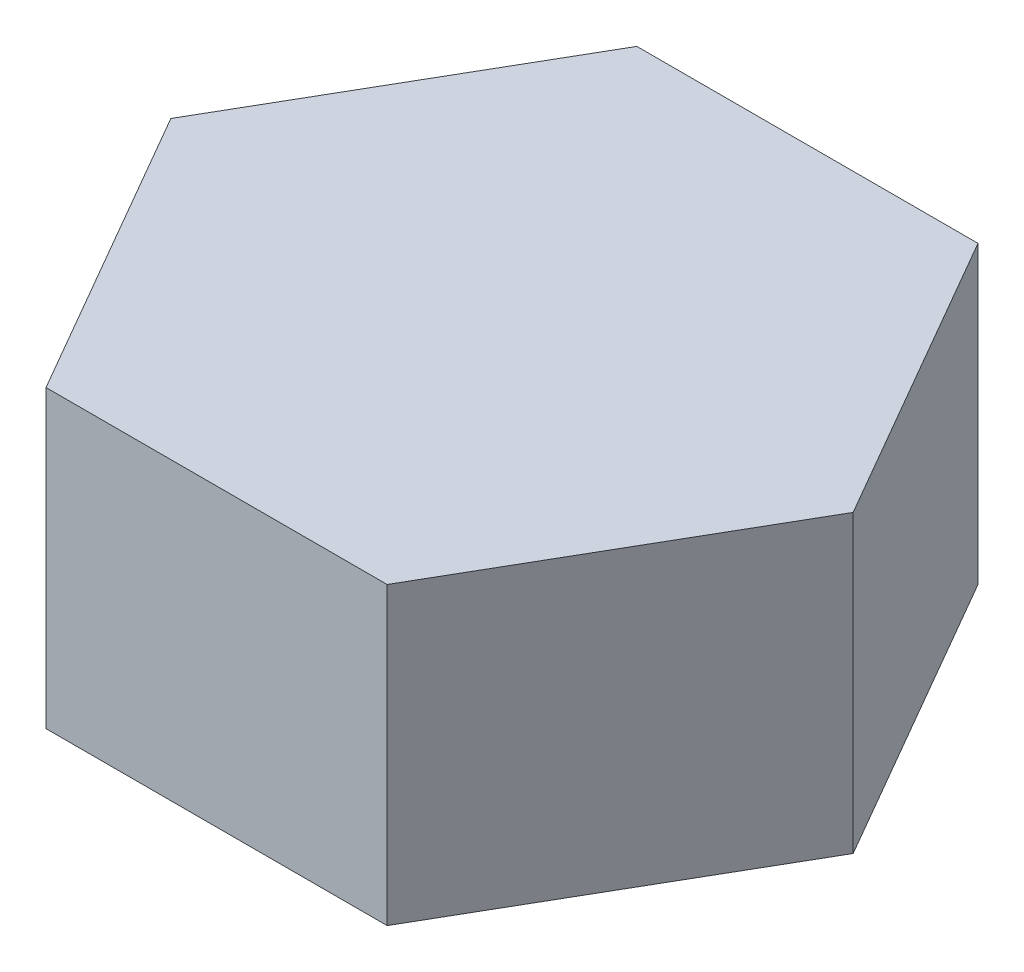
from build123d import *

# Parameters (mm, degrees)
EXTRUDE1_DEPTH = 150


with BuildPart() as part:
    # Sketch1 → Extrude1 (new body)
    with BuildSketch(Plane(origin=(0, 0, 0), x_dir=(1, 0, 0), z_dir=(0, 1, 0))):
        Polygon((-86.602540378, 150), (-173.205080757, 0), (-86.602540378, -150), (86.602540378, -150), (173.205080757, 0), (86.602540378, 150), align=None)
    extrude(amount=EXTRUDE1_DEPTH)


solid = part.part
